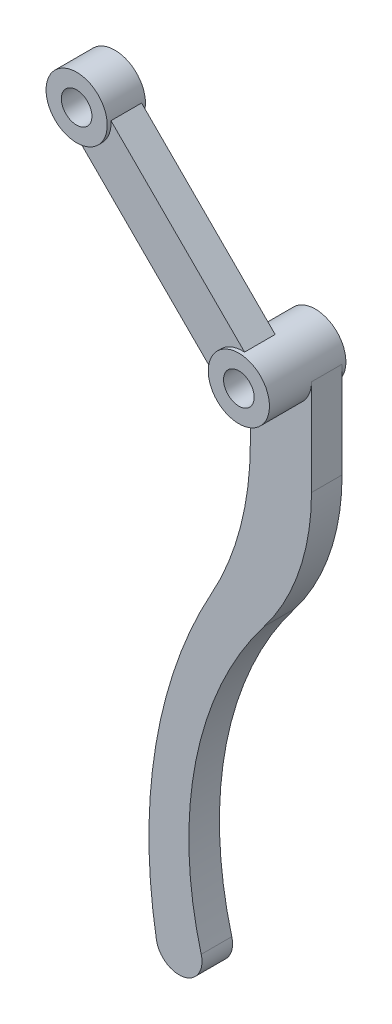
from build123d import *

# Parameters (mm, degrees)
SKETCH_1_R        = 8
SKETCH_1_R_2      = 4
EXTRUDE_1_DEPTH   = 10
EXTRUDE_1_2_DEPTH = 10
EXTRUDE_START     = 1
EXTRUDE_2_DEPTH   = 8
EXTRUDE_START_2   = -9
EXTRUDE_3_DEPTH   = 8
EXTRUDE_START_3   = -10
SKETCH_4_R        = 8
SKETCH_4_R_2      = 4
EXTRUDE_4_DEPTH   = 10


with BuildPart() as part:
    # 草图1 → 凸台-拉伸1 (new body)
    with BuildSketch(Plane.XY):
        Circle(SKETCH_1_R)
        Circle(SKETCH_1_R_2, mode=Mode.SUBTRACT)
    extrude(amount=EXTRUDE_1_DEPTH)



with BuildPart() as body_2:
    # 草图1 → Extrude 1 2 (new body)
    with BuildSketch(Plane.XY):
        with Locations((-42.426406871, 42.426406871)):
            Circle(SKETCH_1_R)
        with Locations((-42.426406871, 42.426406871)):
            Circle(SKETCH_1_R_2, mode=Mode.SUBTRACT)
    extrude(amount=EXTRUDE_1_2_DEPTH)


with BuildPart() as part_1:
    add(part.part)

    add(body_2.part)  # 凸台-拉伸2 merges body 2
    # 草图2 → 凸台-拉伸2 (add)
    with BuildSketch(Plane.XY.offset(EXTRUDE_START)):
        with BuildLine():
            Line((-42.927390172, 34.442108797), (-7.984298074, -0.5009833))
            ThreePointArc((-7.984298074, -0.5009833), (-5.656854249, 5.656854249), (0.5009833, 7.984298074))
            Line((0.5009833, 7.984298074), (-34.442108797, 42.927390172))
            ThreePointArc((-34.442108797, 42.927390172), (-36.769552622, 36.769552622), (-42.927390172, 34.442108797))
        make_face()
    extrude(amount=EXTRUDE_2_DEPTH)



with BuildPart() as body_2_2:
    # 草图3 → 凸台-拉伸3 (new body)
    with BuildSketch(Plane.XY.offset(EXTRUDE_START_2)):
        with BuildLine():
            Line((-8, 0), (-8, -22))
            ThreePointArc((-8, -22), (-10.566583087, -42.101391623), (-18.101648629, -60.912985951))
            ThreePointArc((-18.101648629, -60.912985951), (-32.710853992, -102.552801732), (-32.548897818, -146.680762367))
            ThreePointArc((-32.548897818, -146.680762367), (-25.342004787, -151.498702844), (-20.844170391, -144.087809285))
            ThreePointArc((-20.844170391, -144.087809285), (-22.250809754, -100.941256341), (-4.418535572, -61.626962976))
            ThreePointArc((-4.418535572, -61.626962976), (4.810597012, -44.37728268), (8, -25.075571172))
            Line((8, -25.075571172), (8, 0))
            ThreePointArc((8, 0), (0, -8), (-8, 0))
        make_face()
    extrude(amount=EXTRUDE_3_DEPTH)


with BuildPart() as part_2:
    add(part_1.part)

    add(body_2_2.part)  # 凸台-拉伸4 merges body 2 2
    # 草图4 → 凸台-拉伸4 (add)
    with BuildSketch(Plane.XY.offset(EXTRUDE_START_3)):
        Circle(SKETCH_4_R)
        Circle(SKETCH_4_R_2, mode=Mode.SUBTRACT)
    extrude(amount=EXTRUDE_4_DEPTH)


solid = part_2.part
